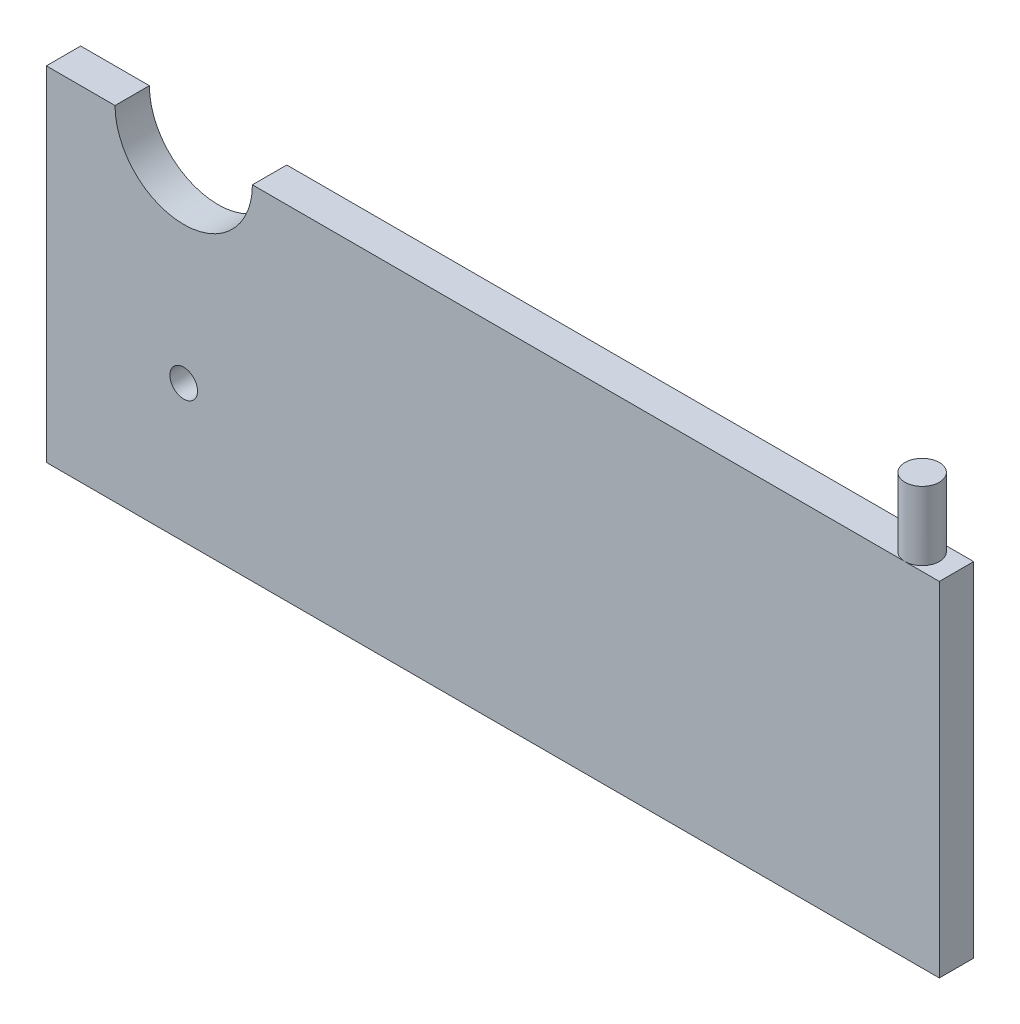
from build123d import *

# Parameters (mm, degrees)
BOSS_EXTRUDE1_DEPTH     = 3.175
F_1_4_20_TAPPED_HOLE1_D = 5.1054
SKETCH4_R               = 3.175
BOSS_EXTRUDE2_DEPTH     = 12.7


with BuildPart() as part:
    # Sketch1 → Boss-Extrude1 (new, symmetric)
    with BuildSketch(Plane.XY):
        with BuildLine():
            Line((-25.4, 25.4), (-12.7, 25.4))
            ThreePointArc((-12.7, 25.4), (0, 12.7), (12.7, 25.4))
            Line((12.7, 25.4), (139.7, 25.4))
            Line((139.7, 25.4), (139.7, -38.1))
            Line((139.7, -38.1), (-25.4, -38.1))
            Line((-25.4, -38.1), (-25.4, 25.4))
        make_face()
    extrude(amount=BOSS_EXTRUDE1_DEPTH, both=True)

    # 1/4-20 Tapped Hole1 (through all)
    with Locations(Plane.XY.offset(3.175)):
        with Locations((0, -12.7)):
            Hole(F_1_4_20_TAPPED_HOLE1_D / 2)

    # Sketch4 → Boss-Extrude2 (add)
    with BuildSketch(Plane(origin=(0, 25.4, 0), x_dir=(1, 0, 0), z_dir=(0, 1, 0))):
        with Locations(Location((133.35, 0, 0), (0, 0, 90))):
            Circle(SKETCH4_R)
    extrude(amount=BOSS_EXTRUDE2_DEPTH)


solid = part.part
